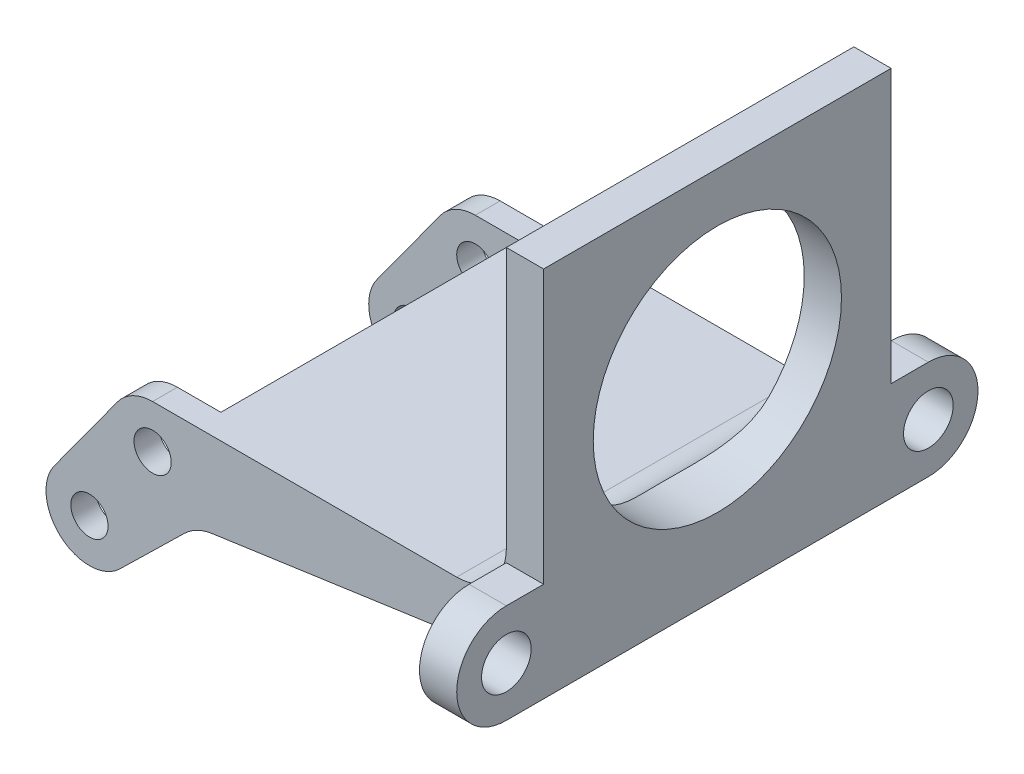
from build123d import *

# Parameters (mm, degrees)
SKETCH2_R           = 3.5
SKETCH2_R_2         = 1.5
BOSS_EXTRUDE1_DEPTH = 2
BOSS_EXTRUDE2_START = -2
BOSS_EXTRUDE2_DEPTH = 2
BOSS_EXTRUDE3_START = -2
SKETCH4_R           = 1.5
BOSS_EXTRUDE3_DEPTH = 2
BOSS_EXTRUDE4_START = -26
SKETCH4_2_R         = 1.5
BOSS_EXTRUDE4_DEPTH = 2
BOSS_EXTRUDE5_START = -28
BOSS_EXTRUDE5_DEPTH = 28
FILLET1_R           = 4
CUT_EXTRUDE1_REACH  = 57.637
SKETCH6_R           = 10
SKETCH7_R           = 2
BOSS_EXTRUDE6_DEPTH = 3


with BuildPart() as part:
    # Sketch2 → Boss-Extrude1 (new body)
    with BuildSketch(Plane.XY):
        Circle(SKETCH2_R)
        Circle(SKETCH2_R_2, mode=Mode.SUBTRACT)
    extrude(amount=BOSS_EXTRUDE1_DEPTH)

    # Sketch3 → Boss-Extrude2 (add)
    with BuildSketch(Plane.XY.offset(2).offset(BOSS_EXTRUDE2_START)):
        with BuildLine():
            Line((3.5, 3.5), (0, 3.5))
            ThreePointArc((0, 3.5), (2.474873734, 2.474873734), (3.5, 0))
            Line((3.5, 0), (3.5, 3.5))
        make_face()
        with BuildLine():
            Line((3.5, -3.5), (3.5, 0))
            ThreePointArc((3.5, 0), (2.474873734, -2.474873734), (0, -3.5))
            Line((0, -3.5), (3.5, -3.5))
        make_face()
    extrude(amount=BOSS_EXTRUDE2_DEPTH)

    # Sketch4 → Boss-Extrude3 (add)
    with BuildSketch(Plane.XY.offset(2).offset(BOSS_EXTRUDE3_START)):
        with BuildLine():
            Line((-2.830776268, 2.058325952), (-7.920645724, -4.941674048))
            ThreePointArc((-7.920645724, -4.941674048), (-7.37878936, -9.647800157), (-2.64377537, -9.503322537))
            Line((-2.64377537, -9.503322537), (3.5, -3.5))
            Line((3.5, -3.5), (3.5, 3.5))
            Line((3.5, 3.5), (0, 3.5))
            ThreePointArc((0, 3.5), (-1.588373251, 3.118825166), (-2.830776268, 2.058325952))
        make_face()
        with Locations((-5.089869456, -7)):
            Circle(SKETCH4_R, mode=Mode.SUBTRACT)
        Circle(SKETCH4_R, mode=Mode.SUBTRACT)
    extrude(amount=BOSS_EXTRUDE3_DEPTH)



with BuildPart() as body_2:
    # Sketch4<2> → Boss-Extrude4 (new body)
    with BuildSketch(Plane.XY.offset(2).offset(BOSS_EXTRUDE4_START)):
        with BuildLine():
            Line((-2.830776268, 2.058325952), (-7.920645724, -4.941674048))
            ThreePointArc((-7.920645724, -4.941674048), (-7.37878936, -9.647800157), (-2.64377537, -9.503322537))
            Line((-2.64377537, -9.503322537), (3.5, -3.5))
            Line((3.5, -3.5), (3.5, 3.5))
            Line((3.5, 3.5), (0, 3.5))
            ThreePointArc((0, 3.5), (-1.588373251, 3.118825166), (-2.830776268, 2.058325952))
        make_face()
        with Locations((-5.089869456, -7)):
            Circle(SKETCH4_2_R, mode=Mode.SUBTRACT)
        Circle(SKETCH4_2_R, mode=Mode.SUBTRACT)
    extrude(amount=-BOSS_EXTRUDE4_DEPTH)


with BuildPart() as part_1:
    add(part.part)

    add(body_2.part)  # Boss-Extrude5 merges body 2
    # Sketch5 → Boss-Extrude5 (add)
    with BuildSketch(Plane.XY.offset(2).offset(BOSS_EXTRUDE5_START)):
        Polygon((3.5, 3.5), (28.5, 3.5), (28.5, 28.5), (31.5, 28.5), (31.5, 0.5), (3.5, -3.5), align=None)
    extrude(amount=BOSS_EXTRUDE5_DEPTH)

    # Fillet1
    fillet1_edges = [part_1.edges().sort_by_distance(p)[0] for p in [
        (3.5, -3.5, 1),
        (3.5, -3.5, -25),
        (28.5, 3.5, -12),
    ]]
    fillet(fillet1_edges, radius=FILLET1_R)

    # Sketch6 → Cut-Extrude1 (cut, up to next)
    with BuildSketch(Plane(origin=(31.5, 0, 0), x_dir=(0, 0, -1), z_dir=(1, 0, 0)), mode=Mode.PRIVATE) as cut_extrude1_sk1:
        with Locations((12, 14.5)):
            Circle(SKETCH6_R)
    cut_extrude1_tool1 = extrude(cut_extrude1_sk1.sketch, amount=-CUT_EXTRUDE1_REACH, mode=Mode.PRIVATE) & part_1.part
    add(cut_extrude1_tool1.solids().sort_by_distance((31.5, 14.5, -12))[0], mode=Mode.SUBTRACT)

    # Sketch7 → Boss-Extrude6 (add)
    # profile 1 of 2: a face of its own
    with BuildSketch(Plane(origin=(31.5, 0, 0), x_dir=(0, 0, -1), z_dir=(1, 0, 0))):
        with BuildLine():
            Line((6, 6.5), (-2, 6.5))
            Line((-2, 6.5), (-2, 0.5))
            Line((-2, 0.5), (26, 0.5))
            Line((26, 0.5), (26, 6.5))
            Line((26, 6.5), (18, 6.5))
            ThreePointArc((18, 6.5), (12, 4.5), (6, 6.5))
        make_face()
    # profile 2 of 2: a face of its own
    with BuildSketch(Plane(origin=(31.5, 0, 0), x_dir=(0, 0, -1), z_dir=(1, 0, 0))):
        with BuildLine():
            Line((-2, 6.5), (-5, 6.5))
            ThreePointArc((-5, 6.5), (-9, 2.5), (-5, -1.5))
            Line((-5, -1.5), (29, -1.5))
            ThreePointArc((29, -1.5), (33, 2.5), (29, 6.5))
            Line((29, 6.5), (26, 6.5))
            Line((26, 6.5), (26, 0.5))
            Line((26, 0.5), (-2, 0.5))
            Line((-2, 0.5), (-2, 6.5))
        make_face()
        with Locations((-5, 2.5)):
            Circle(SKETCH7_R, mode=Mode.SUBTRACT)
        with Locations((29, 2.5)):
            Circle(SKETCH7_R, mode=Mode.SUBTRACT)
    extrude(amount=-BOSS_EXTRUDE6_DEPTH)


solid = part_1.part
